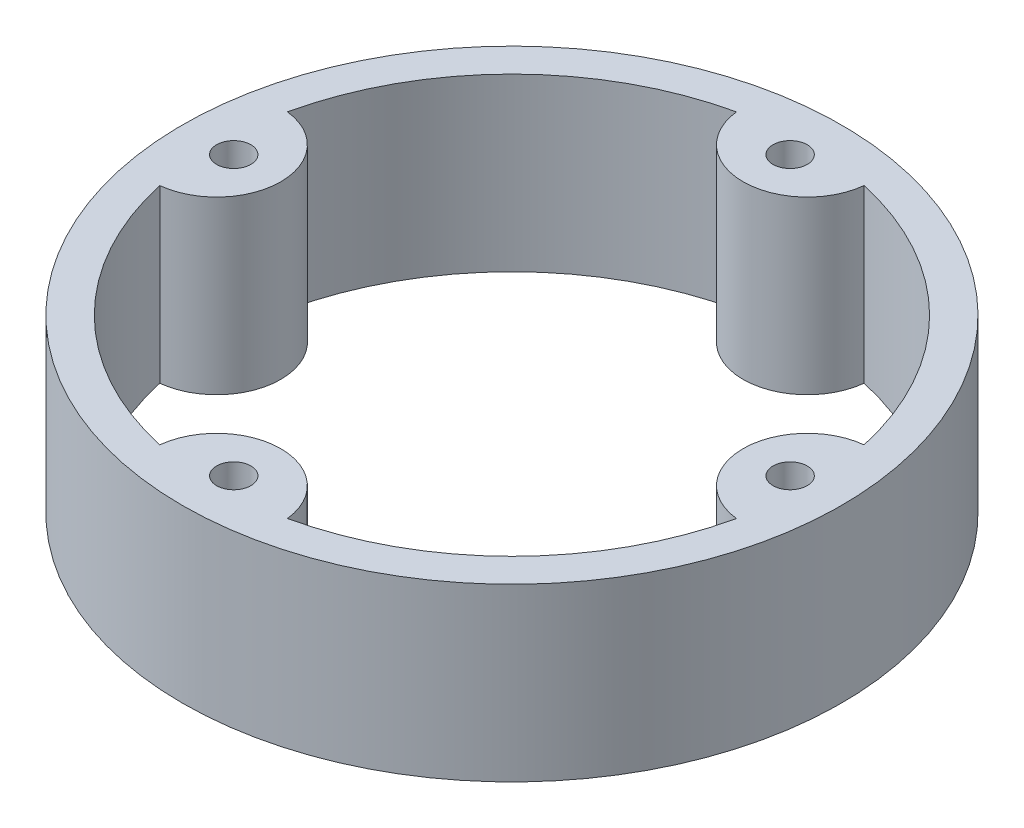
from build123d import *

# Parameters (mm, degrees)
IZIM1_R                     = 38.5
IZIM1_R_2                   = 2
Y_KSEKLIK_EKSTR_ZYON1_DEPTH = 20


with BuildPart() as part:
    # Çizim1 → Yükseklik-Ekstrüzyon1 (new body)
    with BuildSketch(Plane(origin=(0, 0, 0), x_dir=(1, 0, 0), z_dir=(0, 1, 0))):
        with Locations(Location((0, 0, 0), (0, 0, 270))):
            Circle(IZIM1_R)
        with Locations(Location((0, 32.5, 0), (0, 0, 270))):
            Circle(IZIM1_R_2, mode=Mode.SUBTRACT)
        with Locations(Location((32.5, 0, 0), (0, 0, 270))):
            Circle(IZIM1_R_2, mode=Mode.SUBTRACT)
        with Locations(Location((0, -32.5, 0), (0, 0, 270))):
            Circle(IZIM1_R_2, mode=Mode.SUBTRACT)
        with Locations(Location((-32.5, 0, 0), (0, 0, 270))):
            Circle(IZIM1_R_2, mode=Mode.SUBTRACT)
        with BuildLine():
            ThreePointArc((-33.684782609, -7.455563064), (-24.395183951, -24.395183951), (-7.455563064, -33.684782609))
            ThreePointArc((-7.455563064, -33.684782609), (0, -27), (7.455563064, -33.684782609))
            ThreePointArc((7.455563064, -33.684782609), (24.395183951, -24.395183951), (33.684782609, -7.455563064))
            ThreePointArc((33.684782609, -7.455563064), (27, 0), (33.684782609, 7.455563064))
            ThreePointArc((33.684782609, 7.455563064), (24.395183951, 24.395183951), (7.455563064, 33.684782609))
            ThreePointArc((7.455563064, 33.684782609), (0, 27), (-7.455563064, 33.684782609))
            ThreePointArc((-7.455563064, 33.684782609), (-24.395183951, 24.395183951), (-33.684782609, 7.455563064))
            ThreePointArc((-33.684782609, 7.455563064), (-27, 0), (-33.684782609, -7.455563064))
        make_face(mode=Mode.SUBTRACT)
    extrude(amount=Y_KSEKLIK_EKSTR_ZYON1_DEPTH)


solid = part.part
